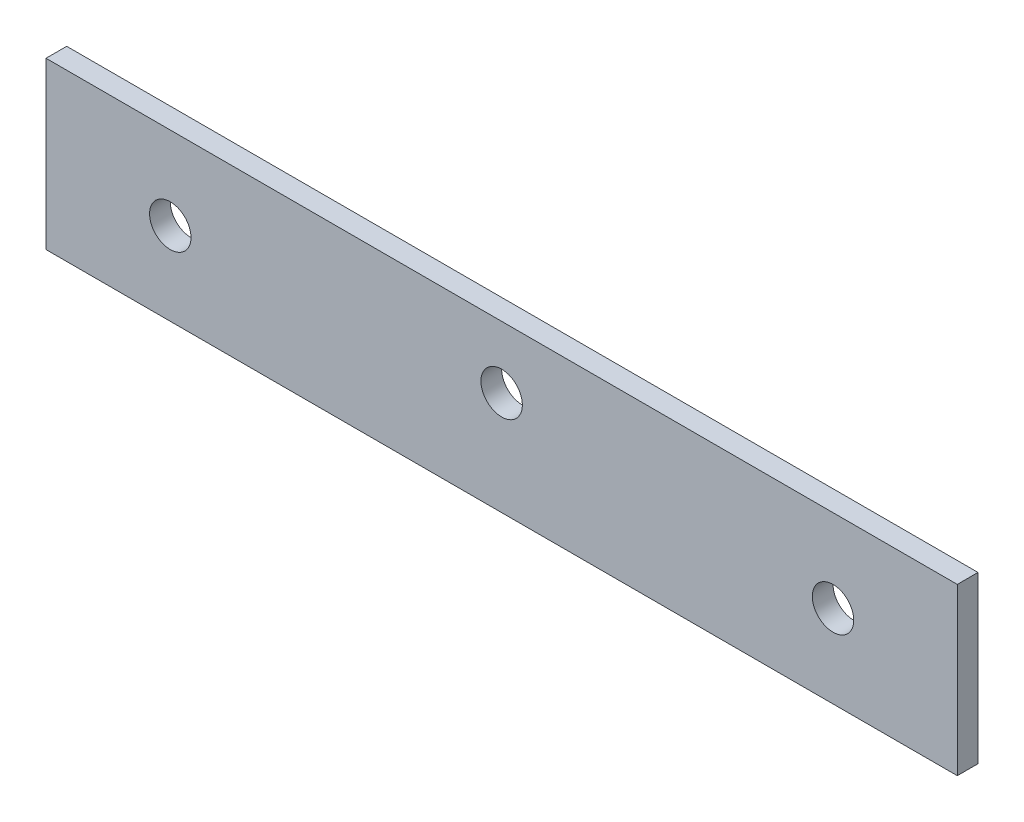
from build123d import *

# Parameters (mm, degrees)
SKETCH_1_W      = 220
SKETCH_1_H      = 40
SKETCH_1_R      = 5
EXTRUDE_1_DEPTH = 5


with BuildPart() as part:
    # ｽｹｯﾁ1 → ﾎﾞｽ - 押し出し1 (new body)
    with BuildSketch(Plane.XY):
        Rectangle(SKETCH_1_W, SKETCH_1_H)
        with Locations((80, 0)):
            Circle(SKETCH_1_R, mode=Mode.SUBTRACT)
        with Locations((-80, 0)):
            Circle(SKETCH_1_R, mode=Mode.SUBTRACT)
        with Locations((0, 5)):
            Circle(SKETCH_1_R, mode=Mode.SUBTRACT)
    extrude(amount=EXTRUDE_1_DEPTH)


solid = part.part
